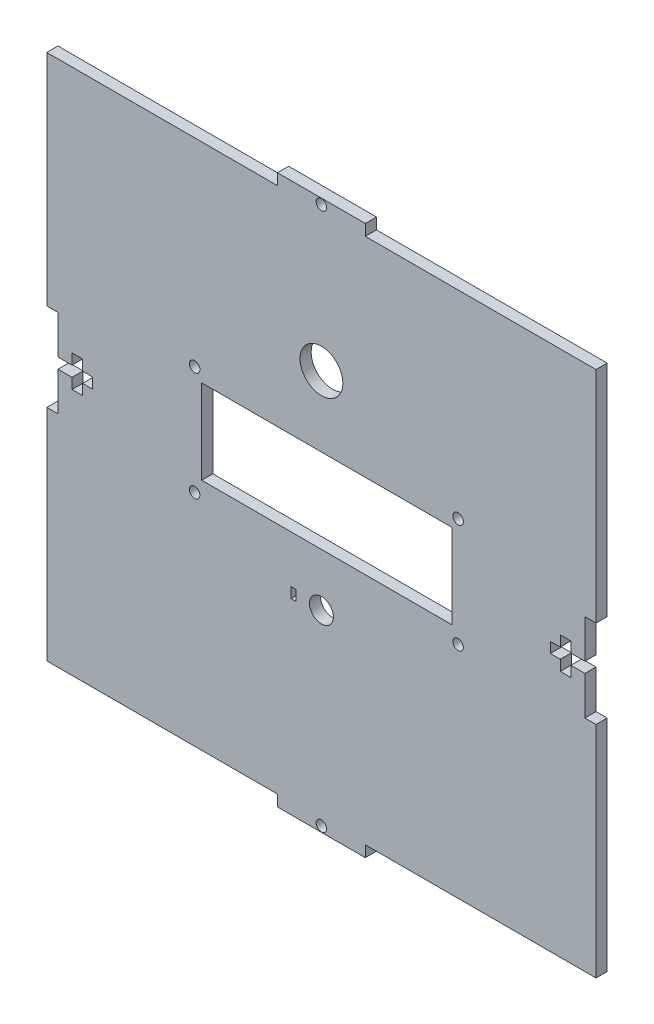
from build123d import *

# Parameters (mm, degrees)
SKETCH1_R           = 1.5
BOSS_EXTRUDE1_DEPTH = 3.18
SKETCH6_R           = 1.5
SKETCH6_W           = 71.2
SKETCH6_H           = 24
CUT_EXTRUDE2_DEPTH  = 10
SKETCH7_R           = 3.4
CUT_EXTRUDE3_DEPTH  = 10
SKETCH8_R           = 6.1
CUT_EXTRUDE4_DEPTH  = 10
SKETCH9_W           = 1.359875129
SKETCH9_H           = 2.955102212
CUT_EXTRUDE5_DEPTH  = 10


with BuildPart() as part:
    # Sketch1 → Boss-Extrude1 (new body)
    with BuildSketch(Plane.XY):
        Polygon((-78.18, 75), (-12.5, 75), (-12.5, 78.18), (12.5, 78.18), (12.5, 75), (78.18, 75), (78.18, 12.5), (75, 12.5), (75, 1.5), (71, 1.5), (71, 4.5), (68, 4.5), (68, 1.5), (65.18, 1.5), (65.18, -1.5), (68, -1.5), (68, -4.5), (71, -4.5), (71, -1.5), (75, -1.5), (75, -12.5), (78.18, -12.5), (78.18, -75), (12.5, -75), (12.5, -78.18), (-12.5, -78.18), (-12.5, -75), (-78.18, -75), (-78.18, -12.5), (-75, -12.5), (-75, -1.5), (-71, -1.5), (-71, -4.5), (-68, -4.5), (-68, -1.5), (-65.18, -1.5), (-65.18, 1.5), (-68, 1.5), (-68, 4.5), (-71, 4.5), (-71, 1.5), (-75, 1.5), (-75, 12.5), (-78.18, 12.5), align=None)
        with Locations(Location((0, -76.59, 0), (0, 0, 180))):
            Circle(SKETCH1_R, mode=Mode.SUBTRACT)
        with Locations(Location((0, 76.59, 0), (0, 0, 180))):
            Circle(SKETCH1_R, mode=Mode.SUBTRACT)
    extrude(amount=BOSS_EXTRUDE1_DEPTH)

    # Sketch6 → Cut-Extrude2 (cut)
    with BuildSketch(Plane.XY.offset(3.18)):
        with Locations((-36.094459363, 18.581758052)):
            Circle(SKETCH6_R)
        with Locations((-36.094459363, -12.418241948)):
            Circle(SKETCH6_R)
        with Locations((38.905540637, -12.418241948)):
            Circle(SKETCH6_R)
        with Locations((38.905540637, 18.581758052)):
            Circle(SKETCH6_R)
        with Locations((1.505540637, 3.581758052)):
            Rectangle(SKETCH6_W, SKETCH6_H)
    extrude(amount=-CUT_EXTRUDE2_DEPTH, mode=Mode.SUBTRACT)

    # Sketch7 → Cut-Extrude3 (cut)
    with BuildSketch(Plane.XY.offset(3.18)):
        with Locations((0, -23.418241948)):
            Circle(SKETCH7_R)
    extrude(amount=-CUT_EXTRUDE3_DEPTH, mode=Mode.SUBTRACT)

    # Sketch8 → Cut-Extrude4 (cut)
    with BuildSketch(Plane.XY.offset(3.18)):
        with Locations((0, 35.581758052)):
            Circle(SKETCH8_R)
    extrude(amount=-CUT_EXTRUDE4_DEPTH, mode=Mode.SUBTRACT)

    # Sketch9 → Cut-Extrude5 (cut)
    with BuildSketch(Plane.XY.offset(3.18)):
        with Locations((-7.96280577, -23.394151807)):
            Rectangle(SKETCH9_W, SKETCH9_H)
    extrude(amount=-CUT_EXTRUDE5_DEPTH, mode=Mode.SUBTRACT)


solid = part.part
